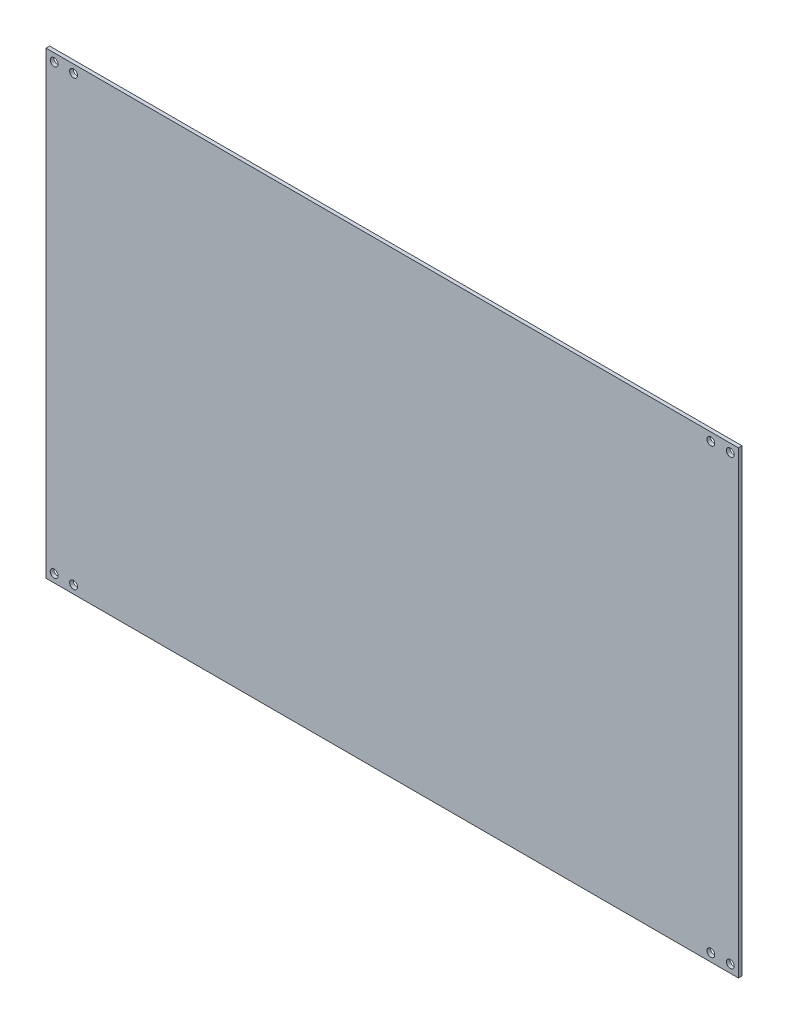
from build123d import *

# Parameters (mm, degrees)
CROQUIS1_W              = 267.2
CROQUIS1_H              = 177.2
SALIENTE_EXTRUIR1_DEPTH = 0.7
CROQUIS2_R              = 1.5
CORTAR_EXTRUIR1_DEPTH   = 15.7


with BuildPart() as part:
    # Croquis1 → Saliente-Extruir1 (new, symmetric)
    with BuildSketch(Plane.XY):
        Rectangle(CROQUIS1_W, CROQUIS1_H)
    extrude(amount=SALIENTE_EXTRUIR1_DEPTH, both=True)

    # Croquis2 → Cortar-Extruir1 (cut, symmetric)
    with BuildSketch(Plane.XY.offset(0.7)):
        with Locations((-130.475, 85.475)):
            Circle(CROQUIS2_R)
        with Locations((-122.975, 85.475)):
            Circle(CROQUIS2_R)
        with Locations((-130.475, -85.475)):
            Circle(CROQUIS2_R)
        with Locations((-122.975, -85.475)):
            Circle(CROQUIS2_R)
        with Locations((130.475, -85.475)):
            Circle(CROQUIS2_R)
        with Locations((122.975, -85.475)):
            Circle(CROQUIS2_R)
        with Locations((130.475, 85.475)):
            Circle(CROQUIS2_R)
        with Locations((122.975, 85.475)):
            Circle(CROQUIS2_R)
    extrude(amount=CORTAR_EXTRUIR1_DEPTH, both=True, mode=Mode.SUBTRACT)


solid = part.part
